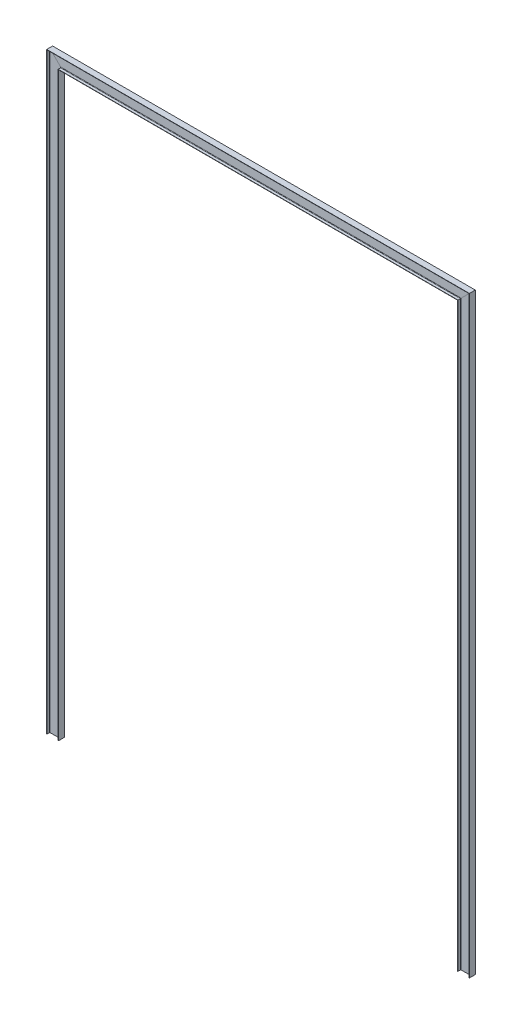
from build123d import *

# Parameters (mm, degrees)
W_SECTION_W8X10_1_DEPTH   = 10113.001976112
W_SECTION_W8X10_1_2_DEPTH = 7226.003952224
W_SECTION_W8X10_1_3_DEPTH = 10113.001976112


with BuildPart() as part:
    # Sketch11 → W section W8X10(1) (new body)
    with BuildSketch(Plane.ZX):
        with BuildLine():
            Line((-50.038, -100.203), (-50.038, -94.996))
            Line((-50.038, -94.996), (-9.779, -94.996))
            ThreePointArc((-9.779, -94.996), (-4.390846327, -92.764153673), (-2.159, -87.376))
            Line((-2.159, -87.376), (-2.159, 87.376))
            ThreePointArc((-2.159, 87.376), (-4.390846327, 92.764153673), (-9.779, 94.996))
            Line((-9.779, 94.996), (-50.038, 94.996))
            Line((-50.038, 94.996), (-50.038, 100.203))
            Line((-50.038, 100.203), (50.038, 100.203))
            Line((50.038, 100.203), (50.038, 94.996))
            Line((50.038, 94.996), (9.779, 94.996))
            ThreePointArc((9.779, 94.996), (4.390846327, 92.764153673), (2.159, 87.376))
            Line((2.159, 87.376), (2.159, -87.376))
            ThreePointArc((2.159, -87.376), (4.390846327, -92.764153673), (9.779, -94.996))
            Line((9.779, -94.996), (50.038, -94.996))
            Line((50.038, -94.996), (50.038, -100.203))
            Line((50.038, -100.203), (-50.038, -100.203))
        make_face()
    extrude(amount=W_SECTION_W8X10_1_DEPTH)

    # W section W8X10(1) mitre 1
    split(bisect_by=Plane(origin=(0, 10000, 0), x_dir=(0.707106781, -0.707106781, 0), z_dir=(-0.707106781, -0.707106781, 0)), keep=Keep.TOP)


with BuildPart() as body_2:
    # Sketch11 on segment 2 (carried to segment 2) → W section W8X10_1 2 (new body)
    with BuildSketch(Plane(origin=(-113.001976112, 10000, 0), x_dir=(0, 0, 1), z_dir=(1, 0, 0))):
        with BuildLine():
            Line((-50.038, -100.203), (-50.038, -94.996))
            Line((-50.038, -94.996), (-9.779, -94.996))
            ThreePointArc((-9.779, -94.996), (-4.390846327, -92.764153673), (-2.159, -87.376))
            Line((-2.159, -87.376), (-2.159, 87.376))
            ThreePointArc((-2.159, 87.376), (-4.390846327, 92.764153673), (-9.779, 94.996))
            Line((-9.779, 94.996), (-50.038, 94.996))
            Line((-50.038, 94.996), (-50.038, 100.203))
            Line((-50.038, 100.203), (50.038, 100.203))
            Line((50.038, 100.203), (50.038, 94.996))
            Line((50.038, 94.996), (9.779, 94.996))
            ThreePointArc((9.779, 94.996), (4.390846327, 92.764153673), (2.159, 87.376))
            Line((2.159, 87.376), (2.159, -87.376))
            ThreePointArc((2.159, -87.376), (4.390846327, -92.764153673), (9.779, -94.996))
            Line((9.779, -94.996), (50.038, -94.996))
            Line((50.038, -94.996), (50.038, -100.203))
            Line((50.038, -100.203), (-50.038, -100.203))
        make_face()
    extrude(amount=W_SECTION_W8X10_1_2_DEPTH)

    # W section W8X10_1 2 mitre 1
    split(bisect_by=Plane(origin=(0, 10000, 0), x_dir=(-0.707106781, 0.707106781, 0), z_dir=(0.707106781, 0.707106781, 0)), keep=Keep.TOP)

    # W section W8X10_1 2 mitre 2
    split(bisect_by=Plane(origin=(7000, 10000, 0), x_dir=(-0.707106781, -0.707106781, 0), z_dir=(-0.707106781, 0.707106781, 0)), keep=Keep.TOP)


with BuildPart() as body_3:
    # Sketch11 on segment 3 (carried to segment 3) → W section W8X10_1 3 (new body)
    with BuildSketch(Plane(origin=(7000, 10113.001976112, 0), x_dir=(0, 0, 1), z_dir=(0, -1, 0))):
        with BuildLine():
            Line((-50.038, -100.203), (-50.038, -94.996))
            Line((-50.038, -94.996), (-9.779, -94.996))
            ThreePointArc((-9.779, -94.996), (-4.390846327, -92.764153673), (-2.159, -87.376))
            Line((-2.159, -87.376), (-2.159, 87.376))
            ThreePointArc((-2.159, 87.376), (-4.390846327, 92.764153673), (-9.779, 94.996))
            Line((-9.779, 94.996), (-50.038, 94.996))
            Line((-50.038, 94.996), (-50.038, 100.203))
            Line((-50.038, 100.203), (50.038, 100.203))
            Line((50.038, 100.203), (50.038, 94.996))
            Line((50.038, 94.996), (9.779, 94.996))
            ThreePointArc((9.779, 94.996), (4.390846327, 92.764153673), (2.159, 87.376))
            Line((2.159, 87.376), (2.159, -87.376))
            ThreePointArc((2.159, -87.376), (4.390846327, -92.764153673), (9.779, -94.996))
            Line((9.779, -94.996), (50.038, -94.996))
            Line((50.038, -94.996), (50.038, -100.203))
            Line((50.038, -100.203), (-50.038, -100.203))
        make_face()
    extrude(amount=W_SECTION_W8X10_1_3_DEPTH)

    # W section W8X10_1 3 mitre 1
    split(bisect_by=Plane(origin=(7000, 10000, 0), x_dir=(0.707106781, 0.707106781, 0), z_dir=(0.707106781, -0.707106781, 0)), keep=Keep.TOP)


solid = Compound([part.part, body_2.part, body_3.part])
